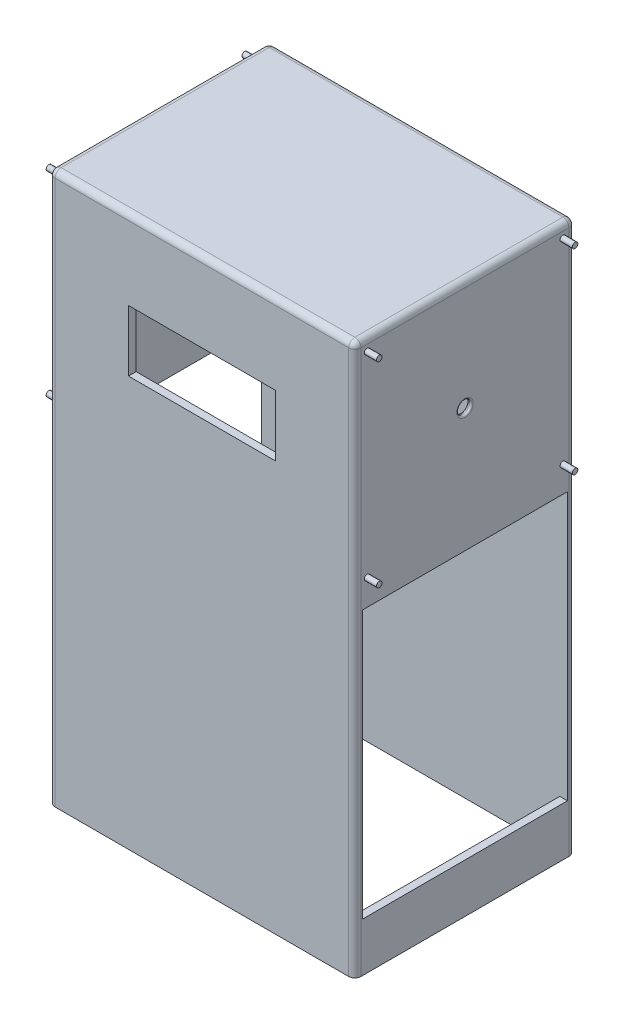
from build123d import *

# Parameters (mm, degrees)
SKETCH1_W           = 127
SKETCH1_H           = 91.44
BOSS_EXTRUDE1_DEPTH = 228.6
SKETCH3_W           = 120.65
SKETCH3_H           = 85.09
CUT_EXTRUDE1_DEPTH  = 226.06
SKETCH2_R           = 2.667
CUT_EXTRUDE2_DEPTH  = 266.475570251
SKETCH4_R           = 1.143
BOSS_EXTRUDE3_DEPTH = 5.08
SKETCH5_R           = 20.32
CUT_EXTRUDE3_DEPTH  = 1.27
FILLET1_R           = 0.762
FILLET2_R           = 0.762
FILLET3_R           = 0.762
SKETCH6_W           = 60.96
SKETCH6_H           = 25.4
CUT_EXTRUDE4_DEPTH  = 256.582569828
FILLET4_R           = 2.54
SKETCH7_W           = 85.09
SKETCH7_H           = 111.152565629
CUT_EXTRUDE5_DEPTH  = 268.942913323


with BuildPart() as part:
    # Sketch1 → Boss-Extrude1 (new body)
    with BuildSketch(Plane(origin=(0, 0, 0), x_dir=(1, 0, 0), z_dir=(0, 1, 0))):
        Rectangle(SKETCH1_W, SKETCH1_H)
    extrude(amount=BOSS_EXTRUDE1_DEPTH)

    # Sketch3 → Cut-Extrude1 (cut)
    with BuildSketch(Plane.XZ):
        Rectangle(SKETCH3_W, SKETCH3_H)
    extrude(amount=-CUT_EXTRUDE1_DEPTH, mode=Mode.SUBTRACT)

    # Sketch2 → Cut-Extrude2 (cut, through all)
    with BuildSketch(Plane(origin=(63.5, 0, 0), x_dir=(0, 0, -1), z_dir=(1, 0, 0))):
        with Locations((0, 182.88)):
            Circle(SKETCH2_R)
    extrude(amount=-CUT_EXTRUDE2_DEPTH, mode=Mode.SUBTRACT)

    # Sketch4 → Boss-Extrude3 (add)
    with BuildSketch(Plane(origin=(63.5, 0, 0), x_dir=(0, 0, -1), z_dir=(1, 0, 0))):
        with Locations(Location((-40.64, 223.52, 0), (0, 0, 180))):
            Circle(SKETCH4_R)
        with Locations(Location((40.64, 223.52, 0), (0, 0, 180))):
            Circle(SKETCH4_R)
        with Locations(Location((40.64, 142.24, 0), (0, 0, 180))):
            Circle(SKETCH4_R)
        with Locations(Location((-40.64, 142.24, 0), (0, 0, 180))):
            Circle(SKETCH4_R)
    boss_extrude3 = extrude(amount=BOSS_EXTRUDE3_DEPTH)

    # Sketch5 → Cut-Extrude3 (cut)
    with BuildSketch(Plane.ZY.offset(-60.325)):
        with Locations((0, 182.88)):
            Circle(SKETCH5_R)
    cut_extrude3 = extrude(amount=-CUT_EXTRUDE3_DEPTH, mode=Mode.SUBTRACT)

    # Fillet1
    fillet1_edges = [part.edges().sort_by_distance(p)[0] for p in [
        (61.595, 182.88, 2.667),
    ]]
    fillet(fillet1_edges, radius=FILLET1_R)

    # Fillet2
    fillet2_edges = [part.edges().sort_by_distance(p)[0] for p in [
        (63.5, 182.88, 2.667),
    ]]
    fillet(fillet2_edges, radius=FILLET2_R)

    # Mirror2: Boss-Extrude3, Cut-Extrude3 across plane
    add(boss_extrude3.mirror(Plane(origin=(0, 0, 0), x_dir=(0, 0, 1), z_dir=(1, 0, 0))))
    add(cut_extrude3.mirror(Plane(origin=(0, 0, 0), x_dir=(0, 0, 1), z_dir=(1, 0, 0))), mode=Mode.SUBTRACT)

    # Fillet3
    fillet3_edges = [part.edges().sort_by_distance(p)[0] for p in [
        (-63.5, 182.88, 2.667),
        (-61.595, 182.88, 2.667),
    ]]
    fillet(fillet3_edges, radius=FILLET3_R)

    # Sketch6 → Cut-Extrude4 (cut, through all)
    with BuildSketch(Plane.XY.offset(45.72)):
        with Locations((0, 182.88)):
            Rectangle(SKETCH6_W, SKETCH6_H)
    extrude(amount=-CUT_EXTRUDE4_DEPTH, mode=Mode.SUBTRACT)

    # Fillet4
    fillet4_edges = [part.edges().sort_by_distance(p)[0] for p in [
        (-63.5, 228.6, 0),
        (0, 228.6, 45.72),
        (63.5, 228.6, 0),
        (63.5, 114.3, 45.72),
        (-63.5, 114.3, 45.72),
        (-63.5, 114.3, -45.72),
        (63.5, 114.3, -45.72),
        (0, 228.6, -45.72),
    ]]
    fillet(fillet4_edges, radius=FILLET4_R)

    # Sketch7 → Cut-Extrude5 (cut, through all)
    with BuildSketch(Plane(origin=(63.5, 0, 0), x_dir=(0, 0, -1), z_dir=(1, 0, 0))):
        with Locations((0, 75.896282814)):
            Rectangle(SKETCH7_W, SKETCH7_H)
    extrude(amount=-CUT_EXTRUDE5_DEPTH, mode=Mode.SUBTRACT)


solid = part.part
